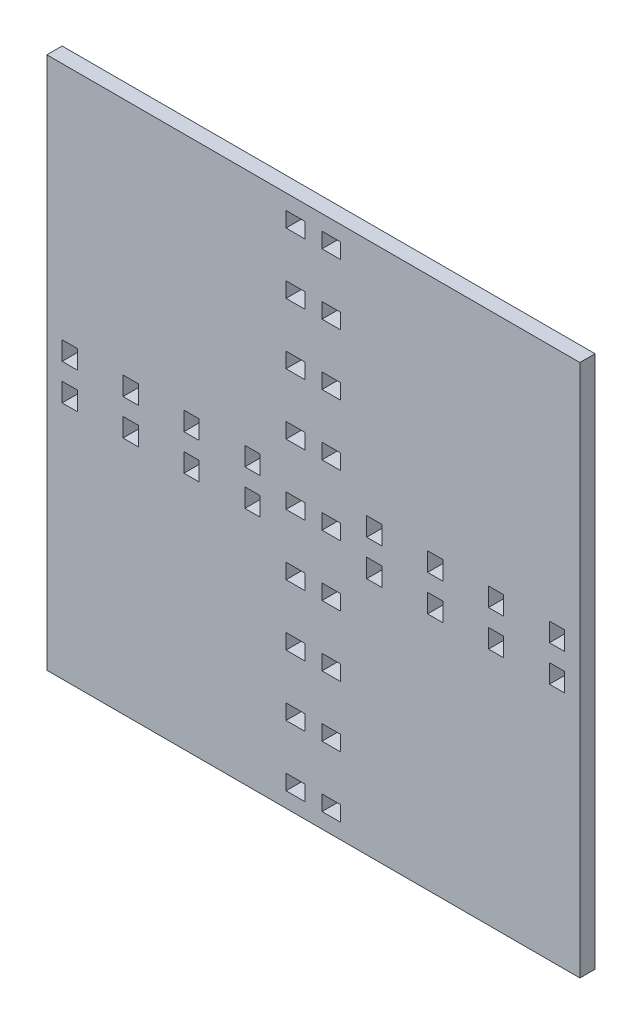
from build123d import *

# Parameters (mm, degrees)
SKETCH1_W           = 105
SKETCH1_H           = 105
SKETCH1_W_2         = 3
SKETCH1_H_2         = 3.682816402
SKETCH1_W_3         = 3.682816402
SKETCH1_H_3         = 3
BOSS_EXTRUDE1_DEPTH = 3


with BuildPart() as part:
    # Sketch1 → Boss-Extrude1 (new body)
    with BuildSketch(Plane.XY):
        with Locations((55.5, 244.5)):
            Rectangle(SKETCH1_W, SKETCH1_H)
        with Locations((19.5, 240.958607901)):
            Rectangle(SKETCH1_W_2, SKETCH1_H_2, mode=Mode.SUBTRACT)
        with Locations((7.5, 240.958607901)):
            Rectangle(SKETCH1_W_2, SKETCH1_H_2, mode=Mode.SUBTRACT)
        with Locations((31.5, 240.958607901)):
            Rectangle(SKETCH1_W_2, SKETCH1_H_2, mode=Mode.SUBTRACT)
        with Locations((51.958607901, 232.5)):
            Rectangle(SKETCH1_W_3, SKETCH1_H_3, mode=Mode.SUBTRACT)
        with Locations((51.958607901, 220.5)):
            Rectangle(SKETCH1_W_3, SKETCH1_H_3, mode=Mode.SUBTRACT)
        with Locations((51.958607901, 280.5)):
            Rectangle(SKETCH1_W_3, SKETCH1_H_3, mode=Mode.SUBTRACT)
        with Locations((51.958607901, 268.5)):
            Rectangle(SKETCH1_W_3, SKETCH1_H_3, mode=Mode.SUBTRACT)
        with Locations((79.5, 240.958607901)):
            Rectangle(SKETCH1_W_2, SKETCH1_H_2, mode=Mode.SUBTRACT)
        with Locations((91.5, 240.958607901)):
            Rectangle(SKETCH1_W_2, SKETCH1_H_2, mode=Mode.SUBTRACT)
        with Locations((51.958607901, 292.5)):
            Rectangle(SKETCH1_W_3, SKETCH1_H_3, mode=Mode.SUBTRACT)
        with Locations((7.5, 248.041392099)):
            Rectangle(SKETCH1_W_2, SKETCH1_H_2, mode=Mode.SUBTRACT)
        with Locations((19.5, 248.041392099)):
            Rectangle(SKETCH1_W_2, SKETCH1_H_2, mode=Mode.SUBTRACT)
        with Locations((31.5, 248.041392099)):
            Rectangle(SKETCH1_W_2, SKETCH1_H_2, mode=Mode.SUBTRACT)
        with Locations((67.5, 248.041392099)):
            Rectangle(SKETCH1_W_2, SKETCH1_H_2, mode=Mode.SUBTRACT)
        with Locations((43.5, 248.041392099)):
            Rectangle(SKETCH1_W_2, SKETCH1_H_2, mode=Mode.SUBTRACT)
        with Locations((79.5, 248.041392099)):
            Rectangle(SKETCH1_W_2, SKETCH1_H_2, mode=Mode.SUBTRACT)
        with Locations((91.5, 248.041392099)):
            Rectangle(SKETCH1_W_2, SKETCH1_H_2, mode=Mode.SUBTRACT)
        with Locations((103.5, 248.041392099)):
            Rectangle(SKETCH1_W_2, SKETCH1_H_2, mode=Mode.SUBTRACT)
        with Locations((43.5, 240.958607901)):
            Rectangle(SKETCH1_W_2, SKETCH1_H_2, mode=Mode.SUBTRACT)
        with Locations((67.5, 240.958607901)):
            Rectangle(SKETCH1_W_2, SKETCH1_H_2, mode=Mode.SUBTRACT)
        with Locations((103.5, 240.958607901)):
            Rectangle(SKETCH1_W_2, SKETCH1_H_2, mode=Mode.SUBTRACT)
        with Locations((59.041392099, 292.5)):
            Rectangle(SKETCH1_W_3, SKETCH1_H_3, mode=Mode.SUBTRACT)
        with Locations((59.041392099, 280.5)):
            Rectangle(SKETCH1_W_3, SKETCH1_H_3, mode=Mode.SUBTRACT)
        with Locations((59.041392099, 268.5)):
            Rectangle(SKETCH1_W_3, SKETCH1_H_3, mode=Mode.SUBTRACT)
        with Locations((59.041392099, 256.5)):
            Rectangle(SKETCH1_W_3, SKETCH1_H_3, mode=Mode.SUBTRACT)
        with Locations((59.041392099, 244.5)):
            Rectangle(SKETCH1_W_3, SKETCH1_H_3, mode=Mode.SUBTRACT)
        with Locations((59.041392099, 232.5)):
            Rectangle(SKETCH1_W_3, SKETCH1_H_3, mode=Mode.SUBTRACT)
        with Locations((59.041392099, 220.5)):
            Rectangle(SKETCH1_W_3, SKETCH1_H_3, mode=Mode.SUBTRACT)
        with Locations((59.041392099, 208.5)):
            Rectangle(SKETCH1_W_3, SKETCH1_H_3, mode=Mode.SUBTRACT)
        with Locations((59.041392099, 196.5)):
            Rectangle(SKETCH1_W_3, SKETCH1_H_3, mode=Mode.SUBTRACT)
        with Locations((51.958607901, 244.5)):
            Rectangle(SKETCH1_W_3, SKETCH1_H_3, mode=Mode.SUBTRACT)
        with Locations((51.958607901, 256.5)):
            Rectangle(SKETCH1_W_3, SKETCH1_H_3, mode=Mode.SUBTRACT)
        with Locations((51.958607901, 196.5)):
            Rectangle(SKETCH1_W_3, SKETCH1_H_3, mode=Mode.SUBTRACT)
        with Locations((51.958607901, 208.5)):
            Rectangle(SKETCH1_W_3, SKETCH1_H_3, mode=Mode.SUBTRACT)
    extrude(amount=BOSS_EXTRUDE1_DEPTH)


solid = part.part
